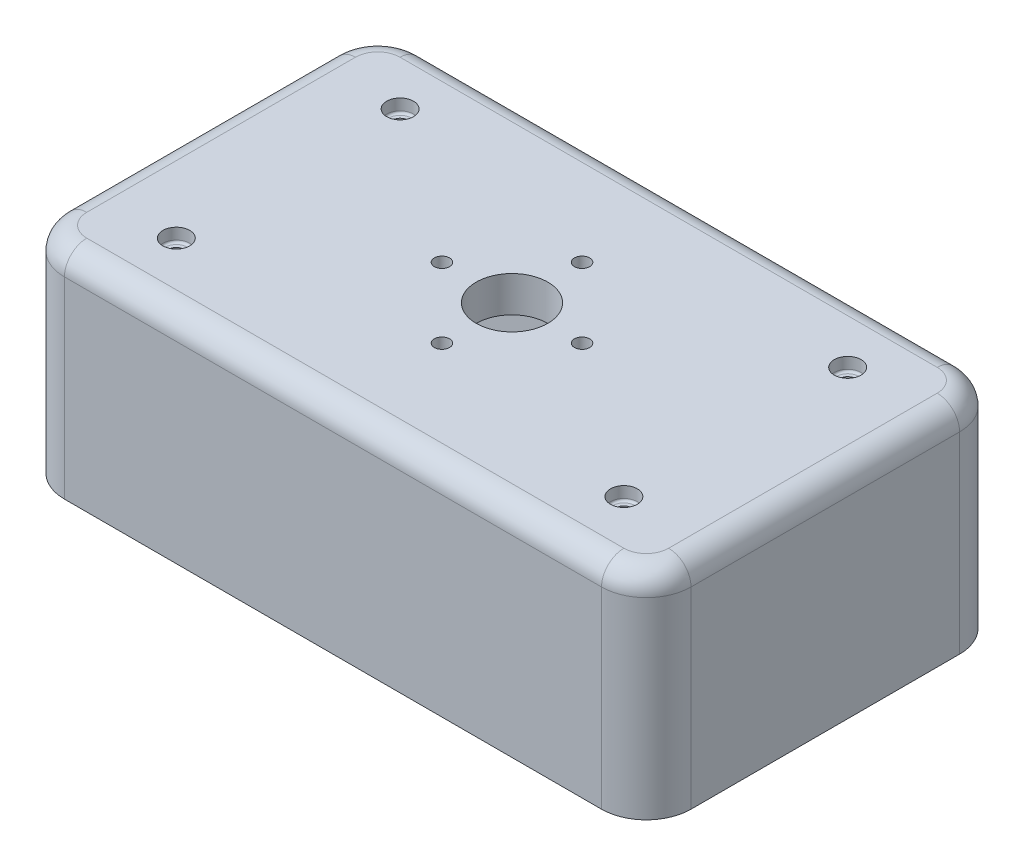
from build123d import *

# Parameters (mm, degrees)
SKETCH1_W           = 140
SKETCH1_H           = 80
BOSS_EXTRUDE1_DEPTH = 48
FILLET1_R           = 10
FILLET2_R           = 5
CUT_EXTRUDE1_DEPTH  = 40
SKETCH3_R           = 3.7
BOSS_EXTRUDE2_DEPTH = 40
SKETCH5_R           = 1.7
CUT_EXTRUDE4_DEPTH  = 94.829632921
SKETCH6_R           = 3
CUT_EXTRUDE5_DEPTH  = 3
FILLET3_R           = 0.5
FILLET4_R           = 2
FILLET5_R           = 1
SKETCH7_R           = 8
CUT_EXTRUDE6_DEPTH  = 94.829632921
SKETCH8_R           = 1.7
CUT_EXTRUDE7_DEPTH  = 94.829632921
CUT_EXTRUDE8_DEPTH  = 2.7


with BuildPart() as part:
    # Sketch1 → Boss-Extrude1 (new body)
    with BuildSketch(Plane(origin=(0, 0, 0), x_dir=(1, 0, 0), z_dir=(0, 1, 0))):
        Rectangle(SKETCH1_W, SKETCH1_H)
    extrude(amount=BOSS_EXTRUDE1_DEPTH)

    # Fillet1
    fillet1_edges = [part.edges().sort_by_distance(p)[0] for p in [
        (70, 24, 40),
        (-70, 24, 40),
        (-70, 24, -40),
        (70, 24, -40),
    ]]
    fillet(fillet1_edges, radius=FILLET1_R)

    # Fillet2
    fillet2_edges = [part.edges().sort_by_distance(p)[0] for p in [
        (-70, 48, 0),
        (0, 48, -40),
        (70, 48, 0),
        (0, 48, 40),
        (-67.071067812, 48, 37.071067812),
        (67.071067812, 48, 37.071067812),
        (67.071067812, 48, -37.071067812),
        (-67.071067812, 48, -37.071067812),
    ]]
    fillet(fillet2_edges, radius=FILLET2_R)

    # Sketch2 → Cut-Extrude1 (cut)
    with BuildSketch(Plane.XZ):
        with BuildLine():
            Line((-55, -35), (55, -35))
            ThreePointArc((55, -35), (62.071067812, -32.071067812), (65, -25))
            Line((65, -25), (65, 25))
            ThreePointArc((65, 25), (62.071067812, 32.071067812), (55, 35))
            Line((55, 35), (-55, 35))
            ThreePointArc((-55, 35), (-62.071067812, 32.071067812), (-65, 25))
            Line((-65, 25), (-65, -25))
            ThreePointArc((-65, -25), (-62.071067812, -32.071067812), (-55, -35))
        make_face()
    extrude(amount=-CUT_EXTRUDE1_DEPTH, mode=Mode.SUBTRACT)

    # Sketch3 → Boss-Extrude2 (add)
    with BuildSketch(Plane(origin=(0, 40, 0), x_dir=(-1, 0, 0), z_dir=(0, -1, 0))):
        with Locations(Location((50, -25, 0), (0, 0, 270))):
            Circle(SKETCH3_R)
        with Locations(Location((-50, -25, 0), (0, 0, 270))):
            Circle(SKETCH3_R)
        with Locations(Location((50, 25, 0), (0, 0, 270))):
            Circle(SKETCH3_R)
        with Locations(Location((-50, 25, 0), (0, 0, 270))):
            Circle(SKETCH3_R)
    extrude(amount=BOSS_EXTRUDE2_DEPTH)

    # Sketch5 → Cut-Extrude4 (cut, through all)
    with BuildSketch(Plane(origin=(0, 0, 0), x_dir=(-1, 0, 0), z_dir=(0, -1, 0))):
        with Locations(Location((50, -25, 0), (0, 0, 90))):
            Circle(SKETCH5_R)
        with Locations(Location((-50, -25, 0), (0, 0, 90))):
            Circle(SKETCH5_R)
        with Locations(Location((50, 25, 0), (0, 0, 90))):
            Circle(SKETCH5_R)
        with Locations(Location((-50, 25, 0), (0, 0, 90))):
            Circle(SKETCH5_R)
    extrude(amount=-CUT_EXTRUDE4_DEPTH, mode=Mode.SUBTRACT)

    # Sketch6 → Cut-Extrude5 (cut)
    with BuildSketch(Plane(origin=(0, 48, 0), x_dir=(1, 0, 0), z_dir=(0, 1, 0))):
        with Locations(Location((-50, 25, 0), (0, 0, 270))):
            Circle(SKETCH6_R)
        with Locations(Location((50, 25, 0), (0, 0, 270))):
            Circle(SKETCH6_R)
        with Locations(Location((-50, -25, 0), (0, 0, 270))):
            Circle(SKETCH6_R)
        with Locations(Location((50, -25, 0), (0, 0, 270))):
            Circle(SKETCH6_R)
    extrude(amount=-CUT_EXTRUDE5_DEPTH, mode=Mode.SUBTRACT)

    # Fillet3
    fillet3_edges = [part.edges().sort_by_distance(p)[0] for p in [
        (50, 45, -28),
        (-50, 45, 22),
        (50, 45, 22),
        (-50, 45, -28),
    ]]
    fillet(fillet3_edges, radius=FILLET3_R)

    # Fillet4
    fillet4_edges = [part.edges().sort_by_distance(p)[0] for p in [
        (-62.071067812, 40, 32.071067812),
        (0, 40, 35),
        (62.071067812, 40, 32.071067812),
        (65, 40, 0),
        (62.071067812, 40, -32.071067812),
        (0, 40, -35),
        (-62.071067812, 40, -32.071067812),
        (-65, 40, 0),
    ]]
    fillet(fillet4_edges, radius=FILLET4_R)

    # Fillet5
    fillet5_edges = [part.edges().sort_by_distance(p)[0] for p in [
        (-50, 40, 21.3),
        (50, 40, -28.7),
        (-50, 40, -28.7),
        (50, 40, 21.3),
    ]]
    fillet(fillet5_edges, radius=FILLET5_R)

    # Sketch7 → Cut-Extrude6 (cut, through all)
    with BuildSketch(Plane(origin=(0, 48, 0), x_dir=(1, 0, 0), z_dir=(0, 1, 0))):
        with Locations(Location((0, 0, 0), (0, 0, 270))):
            Circle(SKETCH7_R)
    extrude(amount=-CUT_EXTRUDE6_DEPTH, mode=Mode.SUBTRACT)

    # Sketch8 → Cut-Extrude7 (cut, through all)
    with BuildSketch(Plane(origin=(0, 48, 0), x_dir=(1, 0, 0), z_dir=(0, 1, 0))):
        with Locations(Location((0, 15.65, 0), (0, 0, 270))):
            Circle(SKETCH8_R)
        with Locations(Location((15.65, 0, 0), (0, 0, 270))):
            Circle(SKETCH8_R)
        with Locations(Location((0, -15.65, 0), (0, 0, 270))):
            Circle(SKETCH8_R)
        with Locations(Location((-15.65, 0, 0), (0, 0, 270))):
            Circle(SKETCH8_R)
    extrude(amount=-CUT_EXTRUDE7_DEPTH, mode=Mode.SUBTRACT)

    # Sketch9 → Cut-Extrude8 (cut)
    with BuildSketch(Plane.XZ.offset(-40)):
        Polygon((3, 15.65), (1.5, 18.248076211), (-1.5, 18.248076211), (-3, 15.65), (-1.5, 13.051923789), (1.5, 13.051923789), align=None)
        Polygon((18.65, 0), (17.15, 2.598076211), (14.15, 2.598076211), (12.65, 0), (14.15, -2.598076211), (17.15, -2.598076211), align=None)
        Polygon((3, -15.65), (1.5, -13.051923789), (-1.5, -13.051923789), (-3, -15.65), (-1.5, -18.248076211), (1.5, -18.248076211), align=None)
        Polygon((-12.65, 0), (-14.15, 2.598076211), (-17.15, 2.598076211), (-18.65, 0), (-17.15, -2.598076211), (-14.15, -2.598076211), align=None)
    extrude(amount=-CUT_EXTRUDE8_DEPTH, mode=Mode.SUBTRACT)


solid = part.part
